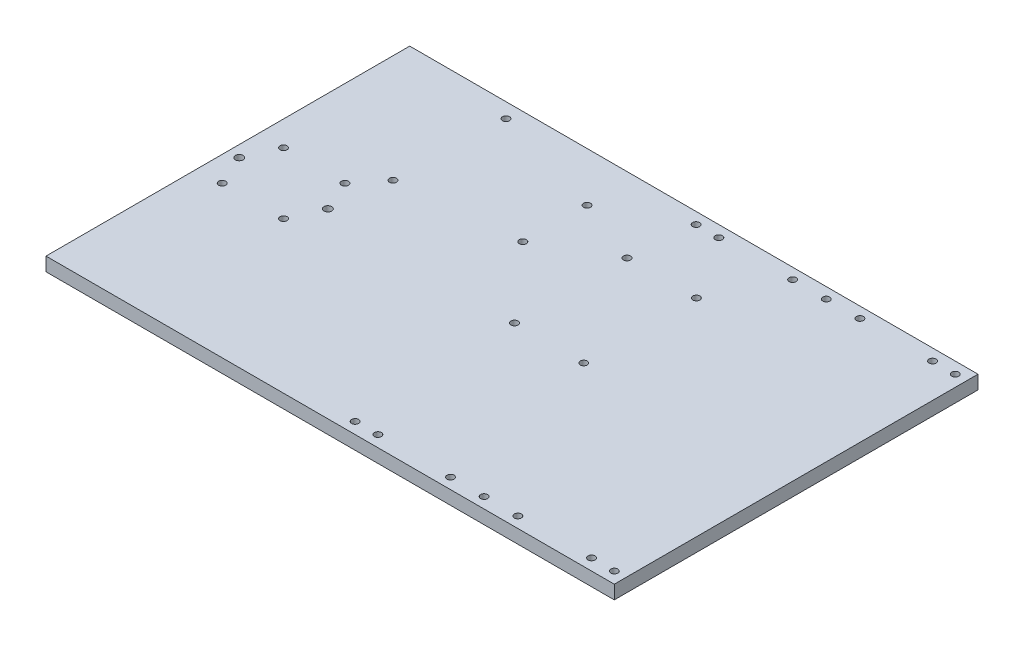
from build123d import *

# Parameters (mm, degrees)
SKETCH1_W            = 250
SKETCH1_H            = 160
BOSS_EXTRUDE1_DEPTH  = 6
M3_CLEARANCE_HOLE1_D = 3.1
M3_CLEARANCE_HOLE2_D = 3.1
M3_CLEARANCE_HOLE3_D = 3.1
M3_CLEARANCE_HOLE4_D = 3.1
M3_CLEARANCE_HOLE5_D = 3.4


with BuildPart() as part:
    # Sketch1 → Boss-Extrude1 (new body)
    with BuildSketch(Plane(origin=(0, 0, 0), x_dir=(1, 0, 0), z_dir=(0, 1, 0))):
        Rectangle(SKETCH1_W, SKETCH1_H)
    extrude(amount=BOSS_EXTRUDE1_DEPTH)

    # M3 Clearance Hole1 (through all)
    with Locations(Plane(origin=(0, 6, 0), x_dir=(1, 0, 0), z_dir=(0, 1, 0))):
        with Locations((6, -75), (16, -75), (110, -75), (120, -75), (120, 75), (110, 75), (16, 75), (6, 75)):
            Hole(M3_CLEARANCE_HOLE1_D / 2)

    # M3 Clearance Hole2 (through all)
    with Locations(Plane(origin=(0, 6, 0), x_dir=(1, 0, 0), z_dir=(0, 1, 0))):
        with Locations((48.19999954, 75.250001403), (62.99999954, 75.250001403), (77.79999954, 75.250001403), (48.2, -75.25), (63, -75.25), (77.8, -75.25)):
            Hole(M3_CLEARANCE_HOLE2_D / 2)

    # M3 Clearance Hole3 (through all)
    with Locations(Plane(origin=(0, 6, 0), x_dir=(1, 0, 0), z_dir=(0, 1, 0))):
        with Locations((-114, -13.5), (-87, -13.5), (-87, 13.5), (-114, 13.5)):
            Hole(M3_CLEARANCE_HOLE3_D / 2)

    # M3 Clearance Hole4 (through all)
    with Locations(Plane(origin=(0, 6, 0), x_dir=(1, 0, 0), z_dir=(0, 1, 0))):
        with Locations((3.54, -2.46), (34.02, -2.46), (34.02, 47.07), (3.54, 47.07), (-77.56, 25.209), (-25.59, 30.359), (-25.36, 58.359), (-76.16, 73.509)):
            Hole(M3_CLEARANCE_HOLE4_D / 2)

    # M3 Clearance Hole5 (through all)
    with Locations(Plane(origin=(0, 0, 0), x_dir=(-1, 0, 0), z_dir=(0, -1, 0))):
        with Locations((81, 0), (120, 0)):
            Hole(M3_CLEARANCE_HOLE5_D / 2)


solid = part.part
